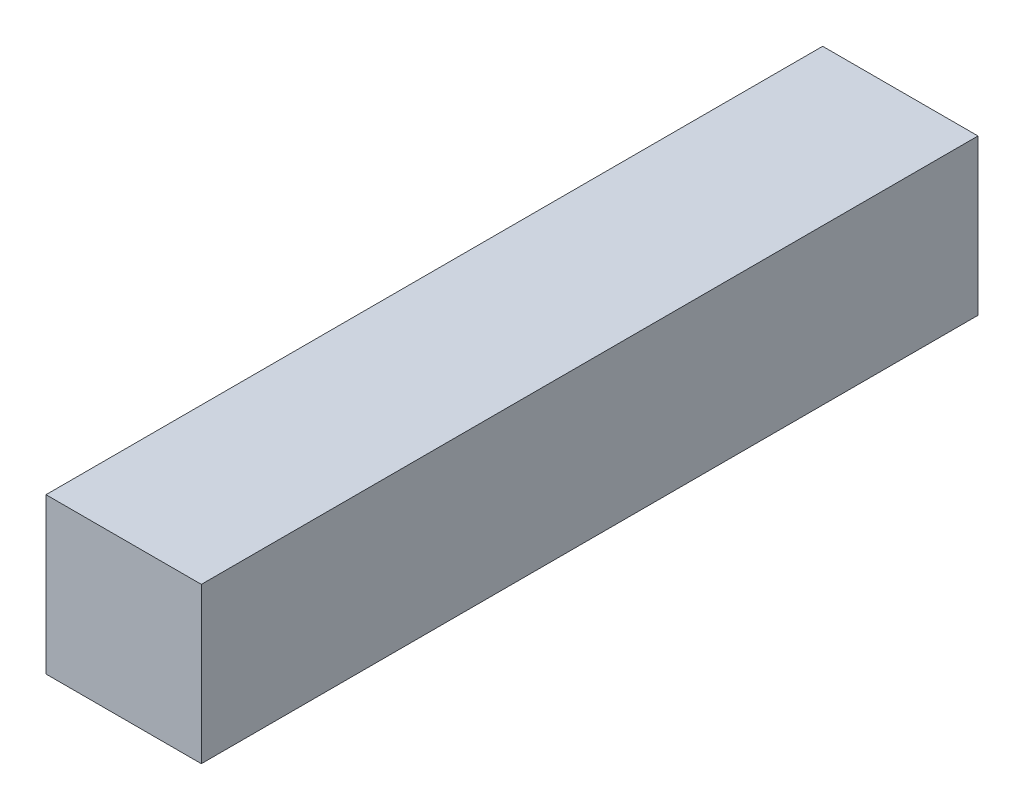
from build123d import *

# Parameters (mm, degrees)
SKETCH1_W           = 4
SKETCH1_H           = 4
BOSS_EXTRUDE1_DEPTH = 20


with BuildPart() as part:
    # Sketch1 → Boss-Extrude1 (new body)
    with BuildSketch(Plane(origin=(0, 0, 0), x_dir=(0, 1, 0), z_dir=(0, 0, 1))):
        Rectangle(SKETCH1_W, SKETCH1_H)
    extrude(amount=BOSS_EXTRUDE1_DEPTH)


solid = part.part
